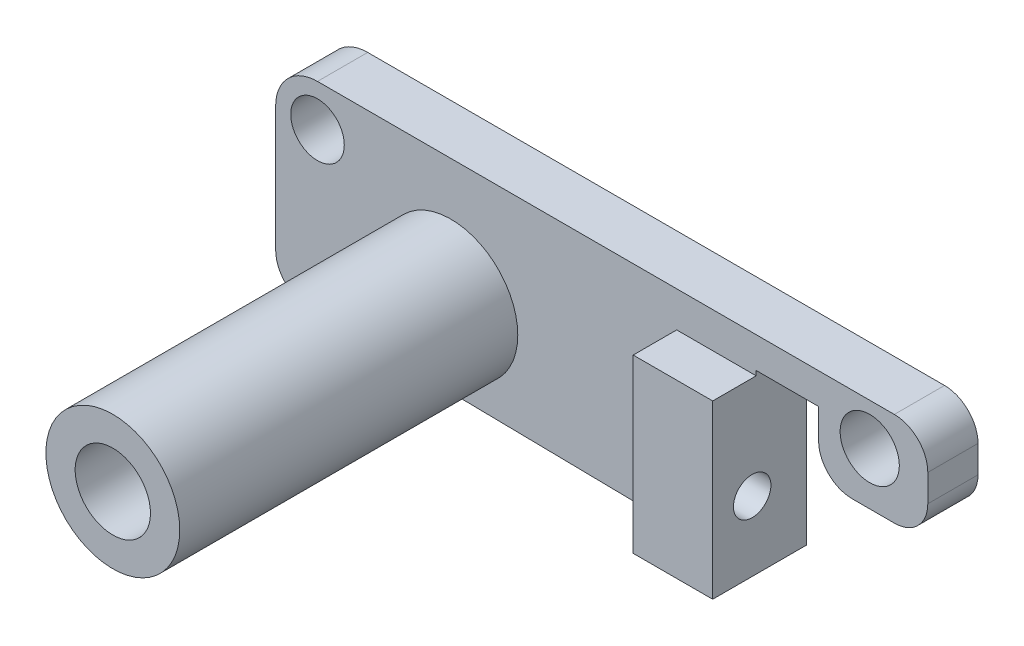
from build123d import *

# Parameters (mm, degrees)
SKETCH1_R           = 1.6
BOSS_EXTRUDE1_DEPTH = 3
SKETCH2_W           = 4.751236483
SKETCH2_H           = 10.264254991
BOSS_EXTRUDE2_DEPTH = 2.6
SKETCH3_R           = 1.118711993
CUT_EXTRUDE1_DEPTH  = 4.751236483
SKETCH4_R           = 1.769310005
CUT_EXTRUDE2_DEPTH  = 5
SKETCH6_R           = 4
BOSS_EXTRUDE3_DEPTH = 20.2
SKETCH7_R           = 2.25
CUT_EXTRUDE3_DEPTH  = 8
FILLET1_R           = 2


with BuildPart() as part:
    # Sketch1 → Boss-Extrude1 (new body)
    with BuildSketch(Plane.XY):
        with BuildLine():
            Line((0, 2.5), (36.470564138, 2.5))
            Line((36.470564138, 2.5), (36.470564138, -3.124783652))
            Line((36.470564138, -3.124783652), (29.945161274, -3.124783652))
            Line((29.945161274, -3.124783652), (29.945161274, 0.647373355))
            Line((29.945161274, 0.647373355), (26.216359637, 0.647373355))
            Line((26.216359637, 0.647373355), (26.216359637, -9.893369232))
            Line((26.216359637, -9.893369232), (-2.5, -9.447534254))
            Line((-2.5, -9.447534254), (-2.5, 0))
            ThreePointArc((-2.5, 0), (-1.767766953, 1.767766953), (0, 2.5))
        make_face()
        Circle(SKETCH1_R, mode=Mode.SUBTRACT)
    extrude(amount=BOSS_EXTRUDE1_DEPTH)

    # Sketch2 → Boss-Extrude2 (add)
    with BuildSketch(Plane.XY.offset(3)):
        with Locations((23.840741396, -4.761241737)):
            Rectangle(SKETCH2_W, SKETCH2_H)
    extrude(amount=BOSS_EXTRUDE2_DEPTH)

    # Sketch3 → Cut-Extrude1 (cut)
    with BuildSketch(Plane(origin=(26.216359637, 0, 0), x_dir=(0, 0, -1), z_dir=(1, 0, 0))):
        with Locations((-3.241173045, -5.729114241)):
            Circle(SKETCH3_R)
    extrude(amount=-CUT_EXTRUDE1_DEPTH, mode=Mode.SUBTRACT)

    # Sketch4 → Cut-Extrude2 (cut)
    with BuildSketch(Plane(origin=(0, 0, 0), x_dir=(-1, 0, 0), z_dir=(0, 0, -1))):
        with Locations((-33, 0)):
            Circle(SKETCH4_R)
    extrude(amount=-CUT_EXTRUDE2_DEPTH, mode=Mode.SUBTRACT)

    # Sketch6 → Boss-Extrude3 (add)
    with BuildSketch(Plane.XY.offset(3)):
        with Locations((7.967965429, -4.6419924)):
            Circle(SKETCH6_R)
    extrude(amount=BOSS_EXTRUDE3_DEPTH)

    # Sketch7 → Cut-Extrude3 (cut)
    with BuildSketch(Plane.XY.offset(23.2)):
        with Locations((7.967965429, -4.6419924)):
            Circle(SKETCH7_R)
    extrude(amount=-CUT_EXTRUDE3_DEPTH, mode=Mode.SUBTRACT)

    # Fillet1
    fillet1_edges = [part.edges().sort_by_distance(p)[0] for p in [
        (36.470564138, 2.5, 1.5),
        (36.470564138, -3.124783652, 1.5),
        (29.945161274, -3.124783652, 1.5),
        (-2.5, -9.447534254, 1.5),
    ]]
    fillet(fillet1_edges, radius=FILLET1_R)


solid = part.part
